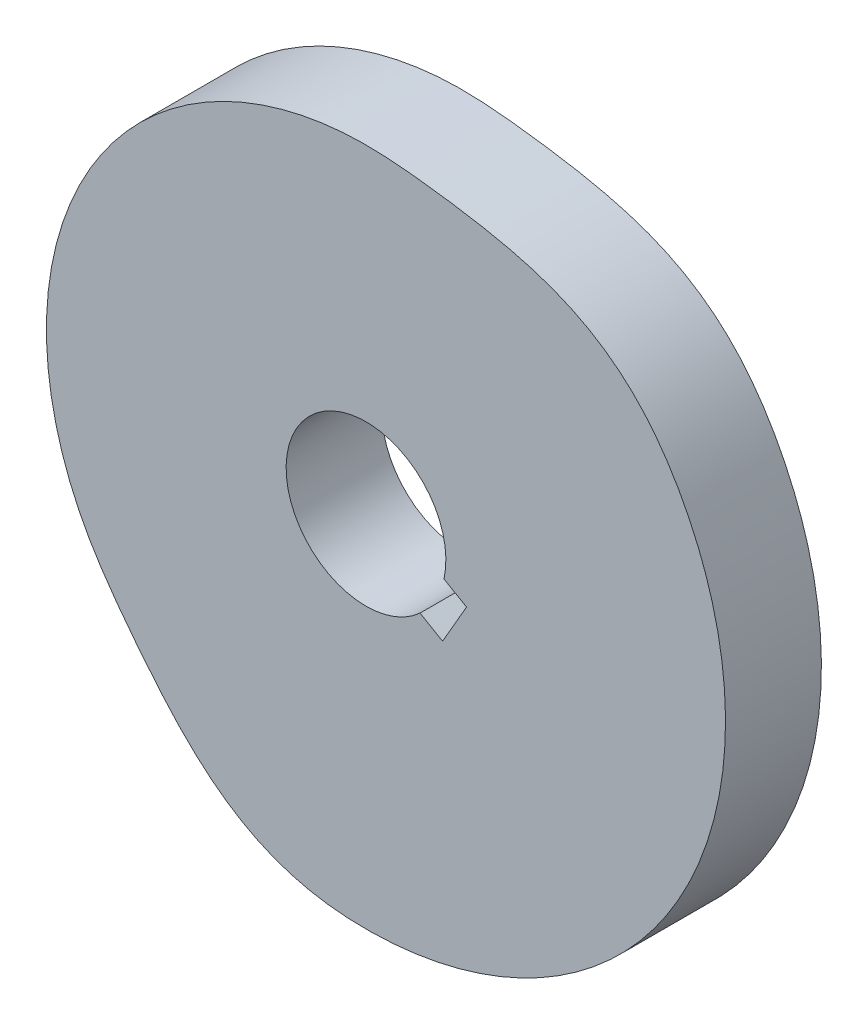
from build123d import *

# Parameters (mm, degrees)
EXTRUDE_1_DEPTH          = 12
CUT_EXTRUDE_1_DEPTH      = 12
CUT_EXTRUDE_1_DEPTH_BACK = 12


with BuildPart() as part:
    # 草图1 → 凸台-拉伸1 (new body)
    with BuildSketch(Plane.XY):
        with BuildLine():
            add(Edge.make_bspline(
                [(41.604091405, 17.149331717), (53.843754098, -12.543956268), (37.785261841, -40.35808075), (5.950288778, -44.604865917), (4.644410509, -44.779070068), (2.017353663, -45.012783391), (-1.979482877, -45.023160927), (-4.606677676, -44.760766568), (-5.906585649, -44.546513449), (-6.021938277, -44.527500826), (-6.394939232, -44.463847801), (-7.02353199, -44.344490532), (-7.789826844, -44.177846129), (-8.551006285, -43.990547434), (-9.306366601, -43.782344994), (-10.055199679, -43.553098452), (-10.796802122, -43.302779375), (-11.530484409, -43.031472601), (-12.255579979, -42.73937609), (-12.971454051, -42.426799279), (-13.677512056, -42.09415998), (-14.37320753, -41.741979863), (-15.05804933, -41.370878602), (-15.731608057, -40.981566772), (-16.393521567, -40.574837604), (-17.043499489, -40.151557733), (-17.681326658, -39.712657057), (-18.306865404, -39.259117879), (-18.920056659, -38.791963465), (-19.520919847, -38.312246209), (-20.109551561, -37.821035543), (-20.686123026, -37.31940579), (-21.250876386, -36.808424103), (-21.804119858, -36.289138682), (-22.346221822, -35.762567407), (-22.877603916, -35.229687052), (-23.398733251, -34.691423221), (-23.910113836, -34.148641142), (-24.412277346, -33.602137436), (-24.905773374, -33.052632959), (-25.391159289, -32.500766815), (-25.868989871, -31.947091613), (-26.339806873, -31.392070001), (-26.804128666, -30.836072544), (-27.262440122, -30.279376925), (-27.715182905, -29.7221685), (-28.162746317, -29.164542162), (-28.605458836, -28.606505484), (-29.043580492, -28.047983083), (-29.477296206, -27.488822134), (-29.90671018, -26.928798938), (-30.331841461, -26.367626442), (-30.75262073, -25.804962595), (-31.168888381, -25.240419403), (-31.580393929, -24.673572552), (-31.986796771, -24.103971433), (-32.387668279, -23.531149436), (-32.782495247, -22.954634315), (-33.170684562, -22.373958572), (-33.463061519, -21.9246755), (-33.626192413, -21.6690786), (-33.663974535, -21.609603802), (-33.889472473, -21.254635796), (-34.331507354, -20.539007198), (-34.963075967, -19.445154915), (-35.360285142, -18.703665049), (-35.552995101, -18.329881051), (-50.371358096, 10.412105082), (-34.202826556, 38.416823194), (-1.902354912, 39.954737464), (-1.482293495, 39.974737743), (-0.641539846, 40.001489439), (0.621548325, 40.001461118), (1.462318311, 39.97646198), (1.882478591, 39.958659041), (1.952876338, 39.955676163), (2.255795194, 39.942199114), (2.791074225, 39.913634778), (3.488048828, 39.867790841), (4.184739053, 39.814118217), (4.881253208, 39.753364306), (5.577743667, 39.68620968), (6.274400215, 39.613258847), (6.971442786, 39.535032082), (7.669113606, 39.45195847), (8.367668884, 39.364370228), (9.067370185, 39.272498416), (9.768475628, 39.176470065), (10.471231044, 39.07630678), (11.175861244, 38.971924832), (11.882561524, 38.863136716), (12.591489567, 38.749654177), (13.302757843, 38.631092623), (14.016426662, 38.506976884), (14.732497978, 38.376748205), (15.45091006, 38.239772383), (16.171533117, 38.095348923), (16.894165968, 37.942721064), (17.618533816, 37.78108656), (18.344287177, 37.609609022), (19.071001996, 37.427429695), (19.798180969, 37.23367948), (20.525256051, 37.027491046), (21.251592153, 36.808010854), (21.976491955, 36.574410941), (22.699201797, 36.325900283), (23.41891857, 36.061735598), (24.134797494, 35.78123144), (24.845960711, 35.483769443), (25.551506534, 35.168806587), (26.250519254, 34.835882393), (26.942079336, 34.484624936), (27.625273883, 34.114755605), (28.299207181, 33.726092553), (28.963011201, 33.318552786), (29.615855866, 32.892152891), (30.256958951, 32.447008371), (30.885595446, 31.983331645), (31.50110623, 31.501428717), (32.102905932, 31.001694605), (32.690489833, 30.484607589), (33.263439702, 29.95072239), (33.821428462, 29.400662388), (34.36422361, 28.835111002), (34.891689323, 28.254802394), (35.30935213, 27.770103731), (35.550977744, 27.478901941), (35.625119472, 27.388509947), (36.460622103, 26.369883178), (38.001459683, 24.225862922), (39.990890744, 20.759312175), (41.102017491, 18.367357547), (41.604091405, 17.149331717)],
                knots=[0, 0, 0, 0, 0.29210674, 0.29210674, 0.29210674, 0.308297228, 0.324487717, 0.340678205, 0.340678205, 0.340678205, 0.342114934, 0.345328317, 0.348540509, 0.351751368, 0.354960755, 0.358168533, 0.361374552, 0.364578648, 0.367780627, 0.370980255, 0.374177251, 0.377371275, 0.380561923, 0.383748719, 0.386931114, 0.390108484, 0.393280136, 0.396445313, 0.399603204, 0.402752957, 0.405893693, 0.409024527, 0.412144586, 0.415253028, 0.418349068, 0.421431996, 0.424501196, 0.427556171, 0.430596554, 0.433622121, 0.436632806, 0.439628702, 0.442610064, 0.445577306, 0.448530992, 0.451471825, 0.454400628, 0.457318325, 0.46022592, 0.463124468, 0.466015049, 0.468898747, 0.471776618, 0.47464967, 0.477518843, 0.48038499, 0.483248864, 0.48611111, 0.488972259, 0.491832731, 0.492698662, 0.492698662, 0.492698662, 0.497866864, 0.503035067, 0.508203269, 0.508203269, 0.508203269, 0.783903471, 0.783903471, 0.783903471, 0.789071673, 0.794239876, 0.799408078, 0.799408078, 0.799408078, 0.800274009, 0.803134481, 0.80599563, 0.808857876, 0.81172175, 0.814587897, 0.81745707, 0.820330122, 0.823207993, 0.826091691, 0.828982272, 0.83188082, 0.834788415, 0.837706112, 0.840634915, 0.843575748, 0.846529434, 0.849496676, 0.852478038, 0.855473934, 0.858484619, 0.861510186, 0.864550569, 0.867605544, 0.870674744, 0.873757671, 0.876853712, 0.879962154, 0.883082213, 0.886213047, 0.889353783, 0.892503536, 0.895661427, 0.898826604, 0.901998256, 0.905175626, 0.908358021, 0.911544817, 0.914735465, 0.917929489, 0.921126485, 0.924326113, 0.927528092, 0.930732188, 0.933938207, 0.937145985, 0.940355372, 0.943566231, 0.946778423, 0.949991806, 0.951428535, 0.951428535, 0.951428535, 0.967619023, 0.983809512, 1, 1, 1, 1], degree=3, weights=[1, 0.740081988, 0.740081988, 1, 1, 1, 1, 1, 1, 1, 1, 1, 1, 1, 1, 1, 1, 1, 1, 1, 1, 1, 1, 1, 1, 1, 1, 1, 1, 1, 1, 1, 1, 1, 1, 1, 1, 1, 1, 1, 1, 1, 1, 1, 1, 1, 1, 1, 1, 1, 1, 1, 1, 1, 1, 1, 1, 1, 1, 1, 1, 1, 1, 1, 1, 1, 1, 0.693747607, 0.693747607, 1, 1, 1, 1, 1, 1, 1, 1, 1, 1, 1, 1, 1, 1, 1, 1, 1, 1, 1, 1, 1, 1, 1, 1, 1, 1, 1, 1, 1, 1, 1, 1, 1, 1, 1, 1, 1, 1, 1, 1, 1, 1, 1, 1, 1, 1, 1, 1, 1, 1, 1, 1, 1, 1, 1, 1, 1, 1, 1, 1, 1, 1, 1, 1]))
        make_face()
    extrude(amount=EXTRUDE_1_DEPTH)

    # 草图2 → 切除-拉伸1 (cut, two sides: drawn at the far end of the back side and taken through both)
    with BuildSketch(Plane.XY.offset(-CUT_EXTRUDE_1_DEPTH_BACK)):
        with BuildLine():
            Line((9.761355821, -2.171619796), (12.585125127, -3.801923765))
            Line((12.585125127, -3.801923765), (9.585125127, -8.998076188))
            Line((9.585125127, -8.998076188), (6.761355821, -7.367772218))
            ThreePointArc((6.761355821, -7.367772218), (-8.660254038, 5), (9.761355821, -2.171619796))
        make_face()
    extrude(amount=CUT_EXTRUDE_1_DEPTH + CUT_EXTRUDE_1_DEPTH_BACK, mode=Mode.SUBTRACT)


solid = part.part
